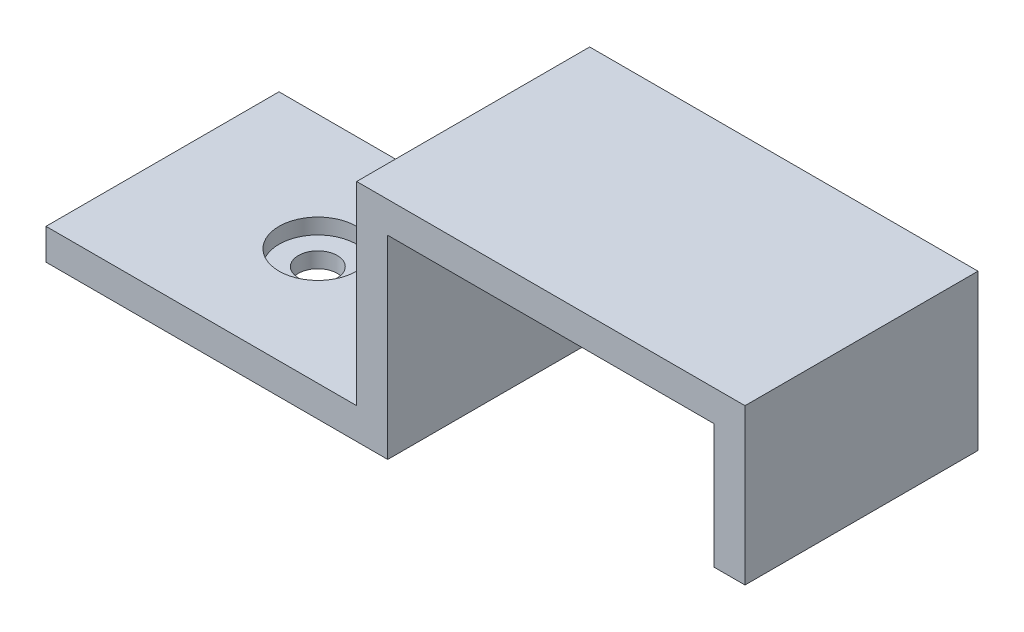
from build123d import *

# Parameters (mm, degrees)
SKETCH1_W           = 40
SKETCH1_H           = 30
BOSS_EXTRUDE1_DEPTH = 4
SKETCH2_R           = 2.5
CUT_EXTRUDE1_DEPTH  = 26.317977802
SKETCH3_R           = 5
CUT_EXTRUDE2_DEPTH  = 2
BOSS_EXTRUDE2_DEPTH = 30


with BuildPart() as part:
    # Sketch1 → Boss-Extrude1 (new body)
    with BuildSketch(Plane(origin=(0, 0, 0), x_dir=(1, 0, 0), z_dir=(0, 1, 0))):
        Rectangle(SKETCH1_W, SKETCH1_H)
    extrude(amount=BOSS_EXTRUDE1_DEPTH)

    # Sketch2 → Cut-Extrude1 (cut, through all)
    with BuildSketch(Plane(origin=(0, 4, 0), x_dir=(1, 0, 0), z_dir=(0, 1, 0))):
        with Locations(Location((0, 0, 0), (0, 0, 270))):
            Circle(SKETCH2_R)
    extrude(amount=-CUT_EXTRUDE1_DEPTH, mode=Mode.SUBTRACT)

    # Sketch3 → Cut-Extrude2 (cut)
    with BuildSketch(Plane(origin=(0, 4, 0), x_dir=(1, 0, 0), z_dir=(0, 1, 0))):
        with Locations(Location((0, 0, 0), (0, 0, 270))):
            Circle(SKETCH3_R)
    extrude(amount=-CUT_EXTRUDE2_DEPTH, mode=Mode.SUBTRACT)

    # Sketch4 → Boss-Extrude2 (add)
    with BuildSketch(Plane(origin=(0, 0, -15), x_dir=(-1, 0, 0), z_dir=(0, 0, -1))):
        Polygon((-24, 0), (-20, 0), (-20, 4), (-20, 25), (-24, 25), align=None)
        Polygon((-66, 25), (-24, 25), (-20, 25), (-20, 29), (-66, 29), align=None)
        Polygon((-66, 9), (-66, 25), (-66, 29), (-70, 29), (-70, 9), align=None)
    extrude(amount=-BOSS_EXTRUDE2_DEPTH)


solid = part.part
